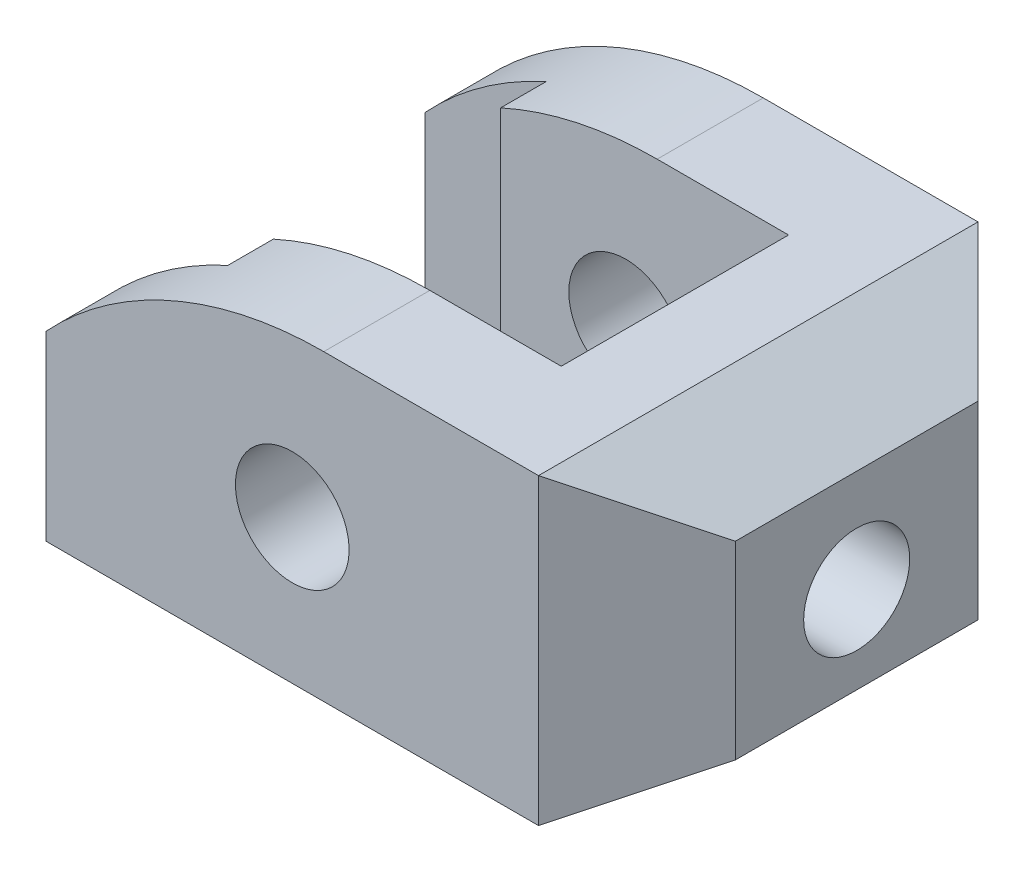
from build123d import *

# Parameters (mm, degrees)
SKETCH1_R               = 7.5
BOSS_EXTRUDE1_DEPTH     = 58
CUT_EXTRUDE1_DEPTH      = 84.865217872
CUT_EXTRUDE1_DEPTH_BACK = 84.865217872
SKETCH2_W               = 38
SKETCH2_H               = 30
CUT_EXTRUDE4_DEPTH      = 84.865217872
CUT_EXTRUDE4_DEPTH_BACK = 84.865217872
SKETCH3_W               = 16
SKETCH3_H               = 6
CUT_EXTRUDE5_DEPTH      = 100.435906681
CUT_EXTRUDE5_DEPTH_BACK = 100.435906681
SKETCH4_R               = 7
CUT_EXTRUDE6_DEPTH      = 84.865217872
CUT_EXTRUDE6_DEPTH_BACK = 84.865217872


with BuildPart() as part:
    # Sketch1 → Boss-Extrude1 (new body)
    with BuildSketch(Plane.XY):
        with BuildLine():
            Line((32.5, -19), (-32.5, -19))
            Line((-32.5, -19), (-32.5, 5))
            ThreePointArc((-32.5, 5), (-15.83939444, 16.82575695), (4.16060556, 21))
            Line((4.16060556, 21), (32.5, 21))
            Line((32.5, 21), (45.490381057, 13.5))
            Line((45.490381057, 13.5), (45.490381057, -11.5))
            Line((45.490381057, -11.5), (32.5, -19))
        make_face()
        with Locations(Location((0, 0, 0), (0, 0, 180))):
            Circle(SKETCH1_R, mode=Mode.SUBTRACT)
    extrude(amount=BOSS_EXTRUDE1_DEPTH)

    # Sketch2 → Cut-Extrude1 (cut, two sides: drawn at the far end of the back side and taken through both)
    with BuildSketch(Plane(origin=(0, 21, 0), x_dir=(1, 0, 0), z_dir=(0, 1, 0)).offset(-CUT_EXTRUDE1_DEPTH_BACK)):
        with Locations((2.5, -29)):
            Rectangle(SKETCH2_W, SKETCH2_H)
    extrude(amount=CUT_EXTRUDE1_DEPTH + CUT_EXTRUDE1_DEPTH_BACK, mode=Mode.SUBTRACT)

    # Sketch3 → Cut-Extrude4 (cut, two sides: drawn at the far end of the back side and taken through both)
    with BuildSketch(Plane(origin=(0, 21, 0), x_dir=(1, 0, 0), z_dir=(0, 1, 0)).offset(-CUT_EXTRUDE4_DEPTH_BACK)):
        with Locations((-24.5, -47)):
            Rectangle(SKETCH3_W, SKETCH3_H)
        with Locations((-24.5, -11)):
            Rectangle(SKETCH3_W, SKETCH3_H)
    extrude(amount=CUT_EXTRUDE4_DEPTH + CUT_EXTRUDE4_DEPTH_BACK, mode=Mode.SUBTRACT)


with BuildPart() as body_2:
    # of the pieces the cut leaves, the one that is kept (cut_extrude4_keep)
    add(part.part.solids().sort_by_distance((4.16060556, 21, 0))[0])

    # Sketch4 → Cut-Extrude5 (cut, two sides: drawn at the far end of the back side and taken through both)
    with BuildSketch(Plane(origin=(45.490381057, 0, 0), x_dir=(0, 0, -1), z_dir=(1, 0, 0)).offset(-CUT_EXTRUDE5_DEPTH_BACK)):
        with Locations(Location((-29, 0, 0), (0, 0, 90))):
            Circle(SKETCH4_R)
    extrude(amount=CUT_EXTRUDE5_DEPTH + CUT_EXTRUDE5_DEPTH_BACK, mode=Mode.SUBTRACT)

    # Sketch6 → Cut-Extrude6 (cut, two sides: drawn at the far end of the back side and taken through both)
    with BuildSketch(Plane(origin=(0, 21, 0), x_dir=(1, 0, 0), z_dir=(0, 1, 0)).offset(-CUT_EXTRUDE6_DEPTH_BACK)):
        Polygon((32.5, 0), (45.490381057, -12.990381057), (45.490381057, 0), align=None)
        Polygon((45.490381057, -45.009618943), (45.490381057, -58), (32.5, -58), align=None)
    extrude(amount=CUT_EXTRUDE6_DEPTH + CUT_EXTRUDE6_DEPTH_BACK, mode=Mode.SUBTRACT)


solid = body_2.part
